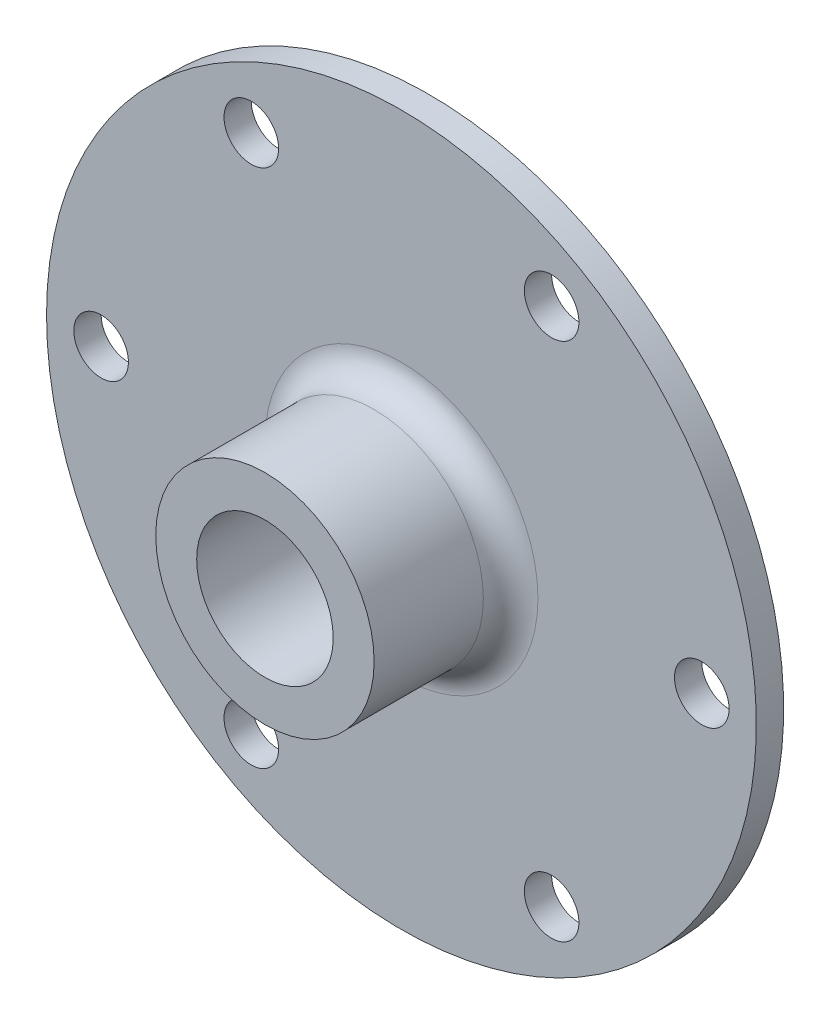
from build123d import *

# Parameters (mm, degrees)
FILLET1_R          = 3.175
SKETCH2_R          = 3.175
CUT_EXTRUDE1_DEPTH = 61.491874454
CIRPATTERN1_COUNT  = 6
SCALE1_SCALE       = 0.5


with BuildPart() as part:
    # Sketch1 → Revolve1 (revolve)
    with BuildSketch(Plane(origin=(0, 0, 0), x_dir=(0, 0, -1), z_dir=(1, 0, 0)), mode=Mode.PRIVATE) as revolve1_sk:
        Polygon((0, 7.9375), (0, 41.275), (-3.175, 41.275), (-3.175, 12.7), (-19.05, 12.7), (-19.05, 7.9375), align=None)
    revolve(revolve1_sk.sketch.rotate(Axis((0, 0, 0), (0, 0, 1)), 90), axis=Axis((0, 0, 0), (0, 0, 1)))

    # Fillet1
    fillet1_edges = [part.edges().sort_by_distance(p)[0] for p in [
        (12.7, 0, 3.175),
    ]]
    fillet(fillet1_edges, radius=FILLET1_R)

    # Sketch2 → Cut-Extrude1 (cut, through all)
    with BuildSketch(Plane.XY.offset(3.175)):
        with Locations((34.925, 0)):
            Circle(SKETCH2_R)
    cut_extrude1 = extrude(amount=-CUT_EXTRUDE1_DEPTH, mode=Mode.SUBTRACT)

    # CirPattern1: Cut-Extrude1 ×6 about axis
    cirpattern1_axis = Axis((0, 0, 0), (0, 0, 1))
    for i in range(1, CIRPATTERN1_COUNT):
        add(cut_extrude1.rotate(cirpattern1_axis, i * 360 / CIRPATTERN1_COUNT), mode=Mode.SUBTRACT)


with BuildPart() as part_1:
    # Scale1: scaled about (0, 0, 3.84726884)
    add(part.part.scale(SCALE1_SCALE).moved(Location((0, 0, 1.92363442))))


solid = part_1.part
